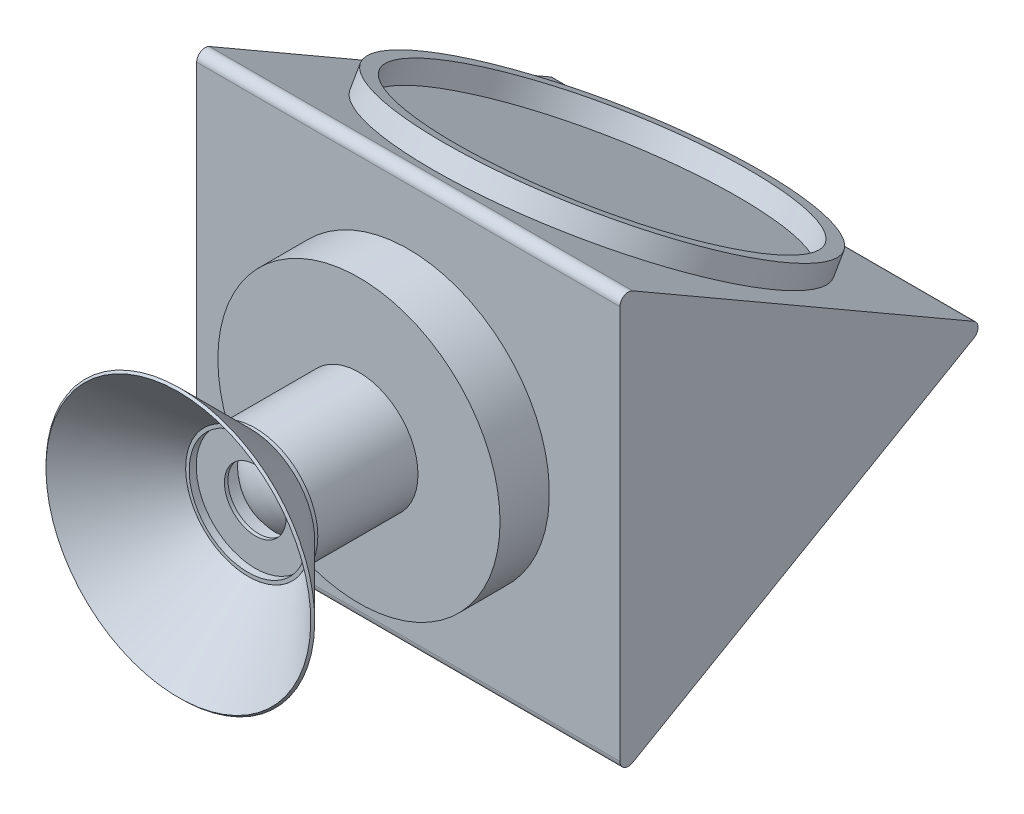
from build123d import *

# Parameters (mm, degrees)
BOSS_EXTRUDE1_DEPTH = 1500
FILLET5_R           = 30
FILLET6_R           = 30
SKETCH5_R           = 500
BOSS_EXTRUDE2_DEPTH = 175
SKETCH10_R          = 209.245879224
SKETCH10_R_2        = 199.245879224
EXTRUDE_THIN2_DEPTH = 355
SKETCH11_R          = 209.245879224
SKETCH11_R_2        = 109.245879224
BOSS_EXTRUDE3_DEPTH = 12.5
SKETCH12_R          = 221.745879224
SKETCH12_R_2        = 209.245879224
BOSS_EXTRUDE5_DEPTH = 25
SKETCH15_R          = 650
SKETCH15_R_2        = 600
BOSS_EXTRUDE6_DEPTH = 75


with BuildPart() as part:
    # Sketch3 → Boss-Extrude1 (new body)
    with BuildSketch(Plane(origin=(0, 0, 0), x_dir=(0, 0, -1), z_dir=(1, 0, 0))):
        Polygon((0, 0), (0, 1500), (1299.038105677, 750), align=None)
    extrude(amount=BOSS_EXTRUDE1_DEPTH)

    # Fillet5
    fillet5_edges = [part.edges().sort_by_distance(p)[0] for p in [
        (750, 1500, 0),
    ]]
    fillet(fillet5_edges, radius=FILLET5_R)

    # Fillet6
    fillet6_edges = [part.edges().sort_by_distance(p)[0] for p in [
        (750, 0, 0),
        (750, 750, -1299.038105677),
    ]]
    fillet(fillet6_edges, radius=FILLET6_R)

    # Sketch5 → Boss-Extrude2 (add)
    with BuildSketch(Plane.XY):
        with Locations(Location((750, 750, 0), (0, 0, 180))):
            Circle(SKETCH5_R)
    extrude(amount=BOSS_EXTRUDE2_DEPTH)

    # Sketch9 → Revolve1 (revolve)
    with BuildSketch(Plane(origin=(750, 0, 0), x_dir=(0, 0, -1), z_dir=(1, 0, 0))):
        with BuildLine():
            Line((-175, 919.722447551), (-425, 919.722447551))
            ThreePointArc((-425, 919.722447551), (-498.140976829, 848.495823773), (-525, 750))
            Line((-525, 750), (-175, 750))
            Line((-175, 750), (-175, 919.722447551))
        make_face()
    revolve(axis=Axis((750, 750, 175), (0, 0, 1)))

    # Sketch10 → Extrude-Thin2 (add)
    with BuildSketch(Plane.XY.offset(175)):
        with Locations((750, 750)):
            Circle(SKETCH10_R)
        with Locations((750, 750)):
            Circle(SKETCH10_R_2, mode=Mode.SUBTRACT)
    extrude(amount=EXTRUDE_THIN2_DEPTH)

    # Sketch11 → Boss-Extrude3 (add)
    with BuildSketch(Plane.XY.offset(530)):
        with Locations((750, 750)):
            Circle(SKETCH11_R)
        with Locations((750, 750)):
            Circle(SKETCH11_R_2, mode=Mode.SUBTRACT)
    extrude(amount=BOSS_EXTRUDE3_DEPTH)

    # Sketch15 → Boss-Extrude6 (add)
    with BuildSketch(Plane(origin=(0, 1125, -649.519052838), x_dir=(1, 0, 0), z_dir=(0, 0.8660254037844382, -0.500000000000001))):
        with Locations(Location((750, 0, 0), (0, 0, 90))):
            Circle(SKETCH15_R)
        with Locations(Location((750, 0, 0), (0, 0, 270))):
            Circle(SKETCH15_R_2, mode=Mode.SUBTRACT)
    extrude(amount=BOSS_EXTRUDE6_DEPTH)


with BuildPart() as body_2:
    # Sketch12 → Boss-Extrude5 (new body)
    with BuildSketch(Plane.XY.offset(542.5)):
        with Locations((750, 750)):
            Circle(SKETCH12_R)
        with Locations((750, 750)):
            Circle(SKETCH12_R_2, mode=Mode.SUBTRACT)
    extrude(amount=BOSS_EXTRUDE5_DEPTH)


with BuildPart() as body_3:
    # Sketch13 → Revolve-Thin1 (revolve)
    with BuildSketch(Plane(origin=(750, 0, 0), x_dir=(0, 0, -1), z_dir=(1, 0, 0))):
        Polygon((-567.5, 971.745879224), (-814.987373415, 1219.233252639), (-807.916305603, 1226.304320451), (-560.428932188, 978.816947036), align=None)
    revolve(axis=Axis((750, 750, -1269.038105677), (0, 0, 1)))


solid = Compound([part.part, body_2.part, body_3.part])
